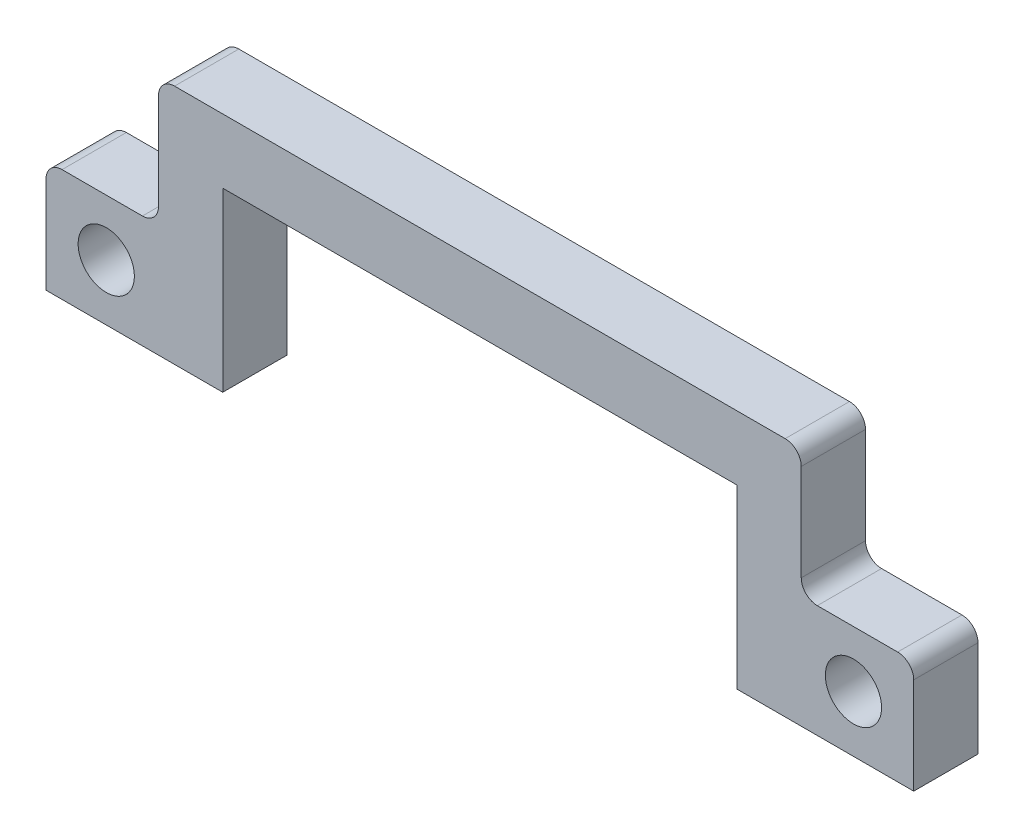
from build123d import *

# Parameters (mm, degrees)
BOSS_EXTRUDE1_DEPTH = 4
SKETCH2_R           = 1.75
CUT_EXTRUDE1_DEPTH  = 4
FILLET1_R           = 1


with BuildPart() as part:
    # Sketch1 → Boss-Extrude1 (new body)
    with BuildSketch(Plane.XY):
        Polygon((-27, -11), (-16, -11), (-16, 0), (16, 0), (16, -11), (27, -11), (27, -4), (20, -4), (20, 4), (-20, 4), (-20, -4), (-27, -4), align=None)
    extrude(amount=BOSS_EXTRUDE1_DEPTH)

    # Sketch2 → Cut-Extrude1 (cut)
    with BuildSketch(Plane.XY.offset(4)):
        with Locations((-23.25, -7.5)):
            Circle(SKETCH2_R)
    cut_extrude1 = extrude(amount=-CUT_EXTRUDE1_DEPTH, mode=Mode.SUBTRACT)

    # Mirror1: Cut-Extrude1 across plane
    add(cut_extrude1.mirror(Plane(origin=(0, 0, 0), x_dir=(0, 0, 1), z_dir=(1, 0, 0))), mode=Mode.SUBTRACT)

    # Fillet1
    fillet1_edges = [part.edges().sort_by_distance(p)[0] for p in [
        (-27, -4, 2),
        (-20, -4, 2),
        (-20, 4, 2),
        (20, 4, 2),
        (20, -4, 2),
        (27, -4, 2),
    ]]
    fillet(fillet1_edges, radius=FILLET1_R)


solid = part.part
